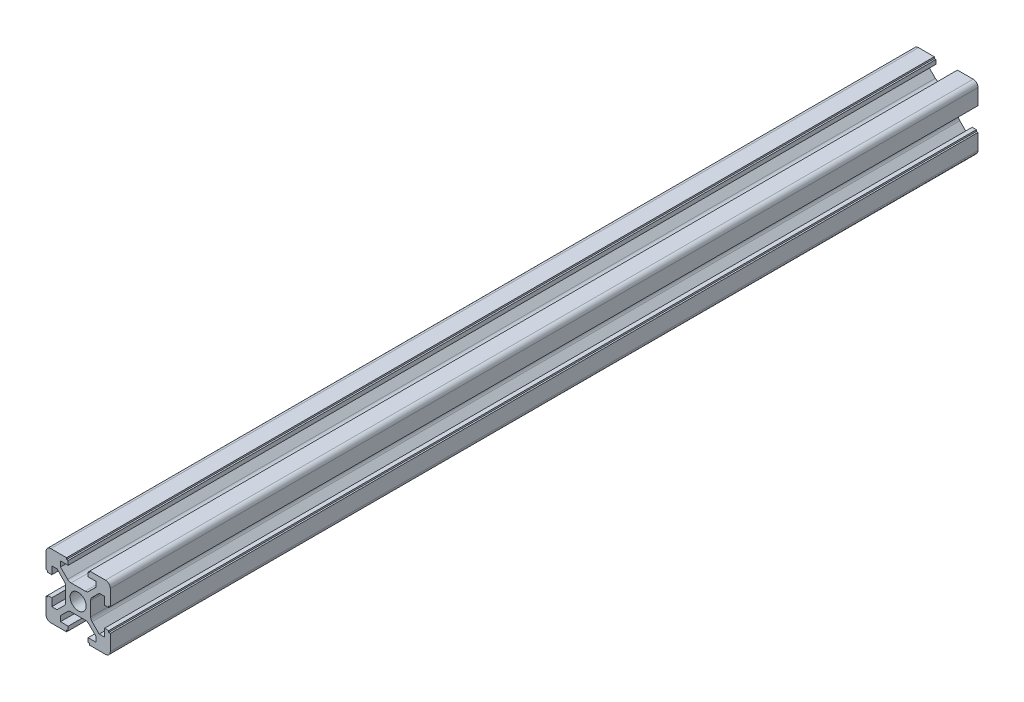
from build123d import *

# Parameters (mm, degrees)
SKETCH_1_R          = 2.5
EXTRUDE_1_DEPTH     = 135
SKETCH_2_R          = 1.6
CUT_EXTRUDE_1_DEPTH = 137.839321834


with BuildPart() as part:
    # 草图1 → 凸台-拉伸1 (new, symmetric)
    with BuildSketch(Plane.XY):
        with BuildLine():
            Line((-6.560660172, 5.5), (-4.339339828, 3.278679656))
            ThreePointArc((-4.339339828, 3.278679656), (-4.014180701, 2.792044633), (-3.9, 2.218019485))
            Line((-3.9, 2.218019485), (-3.9, -2.218019485))
            ThreePointArc((-3.9, -2.218019485), (-4.014180701, -2.792044633), (-4.339339828, -3.278679656))
            Line((-4.339339828, -3.278679656), (-6.560660172, -5.5))
            Line((-6.560660172, -5.5), (-8.2, -5.5))
            Line((-8.2, -5.5), (-8.2, -3.1))
            Line((-8.2, -3.1), (-9.5, -3.1))
            Line((-9.5, -3.1), (-9.5, -3.6))
            Line((-9.5, -3.6), (-10, -3.6))
            Line((-10, -3.6), (-10, -8.5))
            ThreePointArc((-10, -8.5), (-9.560660172, -9.560660172), (-8.5, -10))
            Line((-8.5, -10), (-3.6, -10))
            Line((-3.6, -10), (-3.6, -9.5))
            Line((-3.6, -9.5), (-3.1, -9.5))
            Line((-3.1, -9.5), (-3.1, -8.2))
            Line((-3.1, -8.2), (-5.5, -8.2))
            Line((-5.5, -8.2), (-5.5, -6.560660172))
            Line((-5.5, -6.560660172), (-3.278679656, -4.339339828))
            ThreePointArc((-3.278679656, -4.339339828), (-2.792044633, -4.014180701), (-2.218019485, -3.9))
            Line((-2.218019485, -3.9), (2.218019485, -3.9))
            ThreePointArc((2.218019485, -3.9), (2.792044633, -4.014180701), (3.278679656, -4.339339828))
            Line((3.278679656, -4.339339828), (5.5, -6.560660172))
            Line((5.5, -6.560660172), (5.5, -8.2))
            Line((5.5, -8.2), (3.1, -8.2))
            Line((3.1, -8.2), (3.1, -9.5))
            Line((3.1, -9.5), (3.6, -9.5))
            Line((3.6, -9.5), (3.6, -10))
            Line((3.6, -10), (8.5, -10))
            ThreePointArc((8.5, -10), (9.560660172, -9.560660172), (10, -8.5))
            Line((10, -8.5), (10, -3.6))
            Line((10, -3.6), (9.5, -3.6))
            Line((9.5, -3.6), (9.5, -3.1))
            Line((9.5, -3.1), (8.2, -3.1))
            Line((8.2, -3.1), (8.2, -5.5))
            Line((8.2, -5.5), (6.560660172, -5.5))
            Line((6.560660172, -5.5), (4.339339828, -3.278679656))
            ThreePointArc((4.339339828, -3.278679656), (4.014180701, -2.792044633), (3.9, -2.218019485))
            Line((3.9, -2.218019485), (3.9, 2.218019485))
            ThreePointArc((3.9, 2.218019485), (4.014180701, 2.792044633), (4.339339828, 3.278679656))
            Line((4.339339828, 3.278679656), (6.560660172, 5.5))
            Line((6.560660172, 5.5), (8.2, 5.5))
            Line((8.2, 5.5), (8.2, 3.1))
            Line((8.2, 3.1), (9.5, 3.1))
            Line((9.5, 3.1), (9.5, 3.6))
            Line((9.5, 3.6), (10, 3.6))
            Line((10, 3.6), (10, 8.5))
            ThreePointArc((10, 8.5), (9.560660172, 9.560660172), (8.5, 10))
            Line((8.5, 10), (3.6, 10))
            Line((3.6, 10), (3.6, 9.5))
            Line((3.6, 9.5), (3.1, 9.5))
            Line((3.1, 9.5), (3.1, 8.2))
            Line((3.1, 8.2), (5.5, 8.2))
            Line((5.5, 8.2), (5.5, 6.560660172))
            Line((5.5, 6.560660172), (3.278679656, 4.339339828))
            ThreePointArc((3.278679656, 4.339339828), (2.792044633, 4.014180701), (2.218019485, 3.9))
            Line((2.218019485, 3.9), (-2.218019485, 3.9))
            ThreePointArc((-2.218019485, 3.9), (-2.792044633, 4.014180701), (-3.278679656, 4.339339828))
            Line((-3.278679656, 4.339339828), (-5.5, 6.560660172))
            Line((-5.5, 6.560660172), (-5.5, 8.2))
            Line((-5.5, 8.2), (-3.1, 8.2))
            Line((-3.1, 8.2), (-3.1, 9.5))
            Line((-3.1, 9.5), (-3.6, 9.5))
            Line((-3.6, 9.5), (-3.6, 10))
            Line((-3.6, 10), (-8.5, 10))
            ThreePointArc((-8.5, 10), (-9.560660172, 9.560660172), (-10, 8.5))
            Line((-10, 8.5), (-10, 3.6))
            Line((-10, 3.6), (-9.5, 3.6))
            Line((-9.5, 3.6), (-9.5, 3.1))
            Line((-9.5, 3.1), (-8.2, 3.1))
            Line((-8.2, 3.1), (-8.2, 5.5))
            Line((-8.2, 5.5), (-6.560660172, 5.5))
        make_face()
        Circle(SKETCH_1_R, mode=Mode.SUBTRACT)
    extrude(amount=EXTRUDE_1_DEPTH, both=True)

    # 草图2 → 切除-拉伸1 (cut, through all)
    with BuildSketch(Plane(origin=(0, 10, 0), x_dir=(1, 0, 0), z_dir=(0, 1, 0))):
        with Locations(Location((0, 125, 0), (0, 0, 180))):
            Circle(SKETCH_2_R)
        with Locations(Location((0, 110, 0), (0, 0, 180))):
            Circle(SKETCH_2_R)
        with Locations(Location((0, 95, 0), (0, 0, 180))):
            Circle(SKETCH_2_R)
    extrude(amount=-CUT_EXTRUDE_1_DEPTH, mode=Mode.SUBTRACT)


solid = part.part
